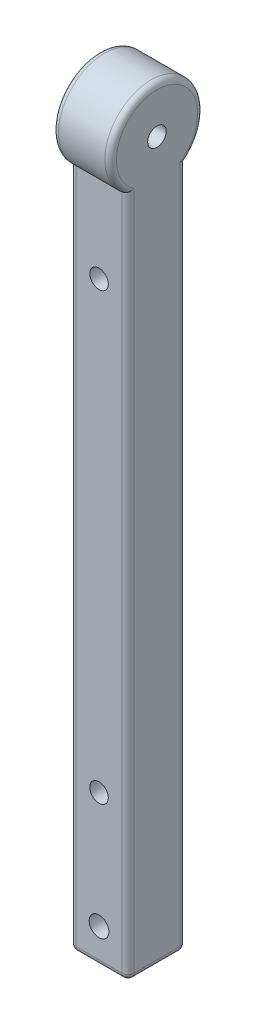
from build123d import *

# Parameters (mm, degrees)
SKETCH2_W           = 12.7
SKETCH2_H           = 165.1
BOSS_EXTRUDE1_DEPTH = 12.7
SKETCH4_R           = 10.16
BOSS_EXTRUDE2_DEPTH = 12.7
SKETCH5_R           = 2.032
CUT_EXTRUDE2_DEPTH  = 95.410065275
SKETCH6_R           = 2.159
CUT_EXTRUDE4_DEPTH  = 131.374531448
FILLET1_R           = 1.27
SKETCH7_R           = 2.032
CUT_EXTRUDE5_DEPTH  = 131.37453153


with BuildPart() as part:
    # Sketch2 → Boss-Extrude1 (new body)
    with BuildSketch(Plane.XY):
        with Locations((-84.455, -9.533605084)):
            Rectangle(SKETCH2_W, SKETCH2_H)
    extrude(amount=BOSS_EXTRUDE1_DEPTH)

    # Sketch4 → Boss-Extrude2 (add)
    with BuildSketch(Plane.ZY.offset(90.805)):
        with Locations((6.35, 65.396394916)):
            Circle(SKETCH4_R)
    extrude(amount=-BOSS_EXTRUDE2_DEPTH)

    # Sketch5 → Cut-Extrude2 (cut, through all)
    with BuildSketch(Plane.ZY.offset(90.805)):
        with Locations((6.35, 65.396394916)):
            Circle(SKETCH5_R)
    extrude(amount=-CUT_EXTRUDE2_DEPTH, mode=Mode.SUBTRACT)

    # Sketch6 → Cut-Extrude4 (cut, through all)
    with BuildSketch(Plane.XY.offset(12.7)):
        with Locations((-84.455, -84.463605084)):
            Circle(SKETCH6_R)
        with Locations((84.455, -84.463605084)):
            Circle(SKETCH6_R)
    extrude(amount=-CUT_EXTRUDE4_DEPTH, mode=Mode.SUBTRACT)

    # Fillet1
    fillet1_edges = [part.edges().sort_by_distance(p)[0] for p in [
        (-90.805, -17.309178813, 0),
        (-90.805, -17.309178813, 12.7),
        (-90.805, 75.556394916, 6.35),
        (-78.105, 75.556394916, 6.35),
        (-84.455, -92.083605084, 12.7),
        (-78.105, -17.309178813, 0),
        (-84.455, -92.083605084, 0),
        (-90.805, -92.083605084, 6.35),
        (-78.105, -92.083605084, 6.35),
        (-78.105, -17.309178813, 12.7),
    ]]
    fillet(fillet1_edges, radius=FILLET1_R)

    # Sketch7 → Cut-Extrude5 (cut, through all)
    with BuildSketch(Plane.XY.offset(12.7)):
        with Locations((-84.455, -59.063605084)):
            Circle(SKETCH7_R)
        with Locations((-84.455, 38.415247458)):
            Circle(SKETCH7_R)
        with Locations((84.455, -59.063605084)):
            Circle(SKETCH7_R)
        with Locations((84.455, 38.415247458)):
            Circle(SKETCH7_R)
    extrude(amount=-CUT_EXTRUDE5_DEPTH, mode=Mode.SUBTRACT)


solid = part.part
